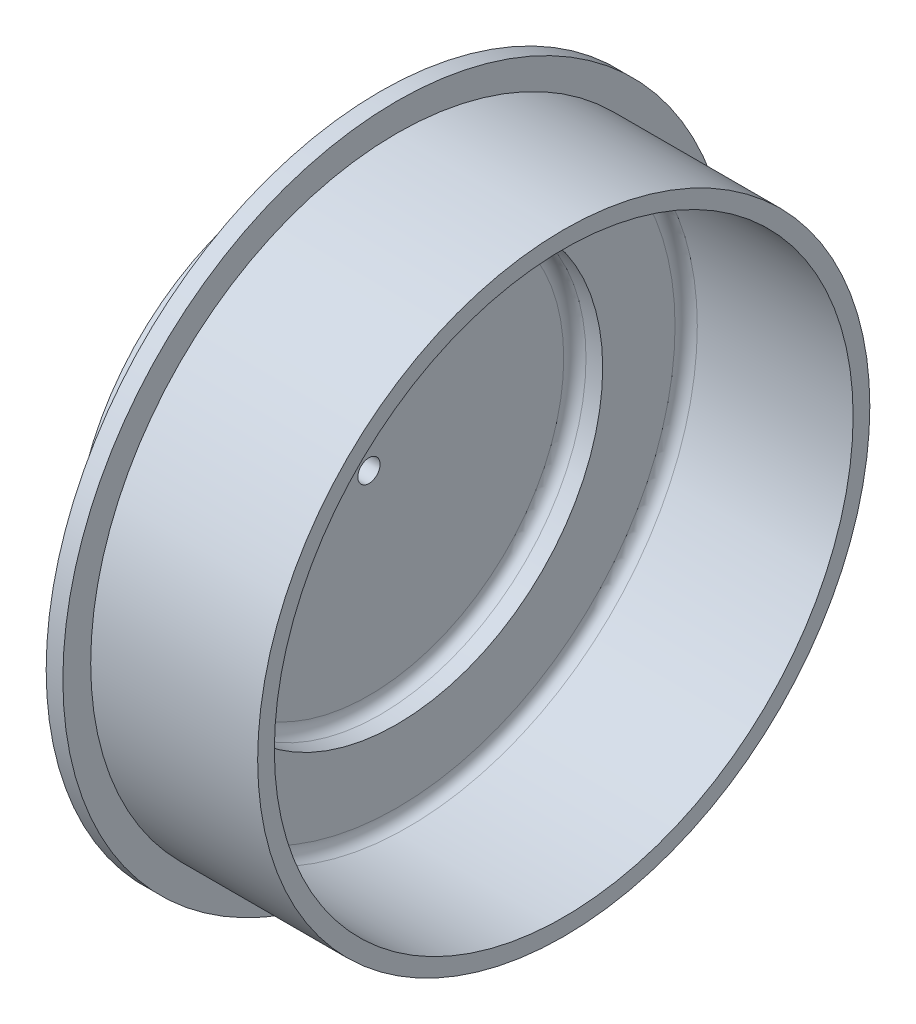
from build123d import *


with BuildPart() as part:
    # Sketch1 → Revolve1 (revolve)
    with BuildSketch(Plane.XY, mode=Mode.PRIVATE) as revolve1_sk:
        with BuildLine():
            Line((0, 40), (0, 37))
            Line((0, 37), (8, 37))
            ThreePointArc((8, 37), (9.414213562, 36.414213562), (10, 35))
            Line((10, 35), (10, 2))
            Line((10, 2), (13, 2))
            Line((13, 2), (13, 35))
            ThreePointArc((13, 35), (13.585786438, 36.414213562), (15, 37))
            Line((15, 37), (18, 37))
            Line((18, 37), (18, 50))
            ThreePointArc((18, 50), (18.585786438, 51.414213562), (20, 52))
            Line((20, 52), (48, 52))
            Line((48, 52), (48, 55))
            Line((48, 55), (18, 55))
            Line((18, 55), (18, 60))
            Line((18, 60), (15, 60))
            Line((15, 60), (15, 52))
            Line((15, 52), (15, 40))
            Line((15, 40), (0, 40))
        make_face()
    revolve(revolve1_sk.sketch.rotate(Axis((0, 0, 0), (1, 0, 0)), 90), axis=Axis((0, 0, 0), (1, 0, 0)))


solid = part.part
